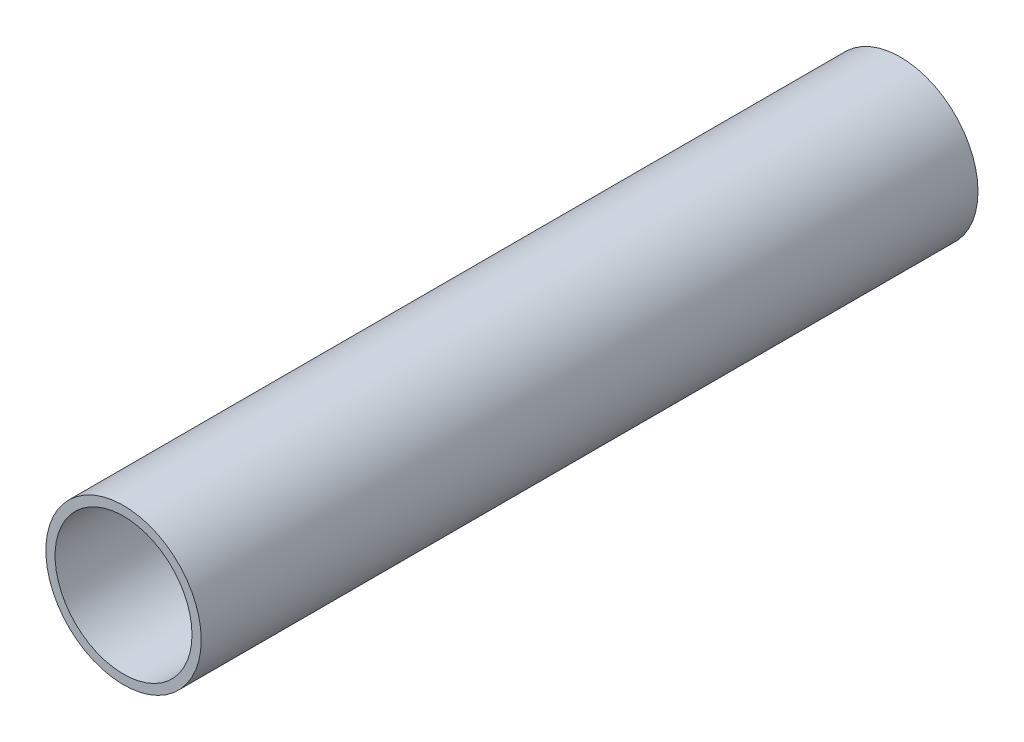
from build123d import *

# Parameters (mm, degrees)
PIPESKETCH_R    = 16
PIPESKETCH_R_2  = 14.1
EXTRUSION_DEPTH = 160


with BuildPart() as part:
    # PipeSketch → Extrusion (new body)
    with BuildSketch(Plane.XY):
        Circle(PIPESKETCH_R)
        Circle(PIPESKETCH_R_2, mode=Mode.SUBTRACT)
    extrude(amount=EXTRUSION_DEPTH)


solid = part.part
